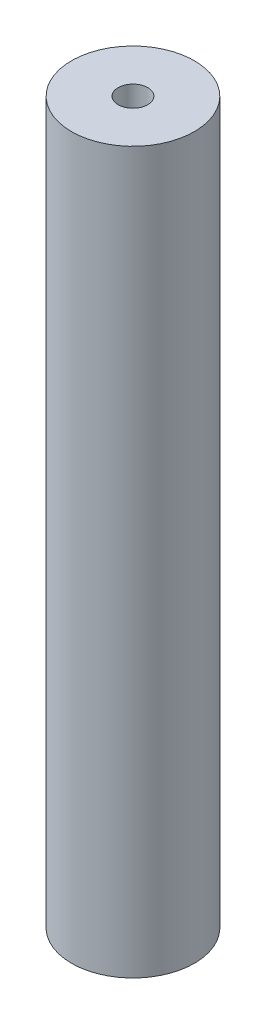
from build123d import *

# Parameters (mm, degrees)
SKETCH_4_R          = 2.9
EXTRUDE_1_DEPTH     = 34
SKETCH_4_5_R        = 0.7
CUT_EXTRUDE_1_DEPTH = 3
CUT_EXTRUDE_START   = 31
SKETCH_4_6_R        = 0.7
CUT_EXTRUDE_2_DEPTH = 3


with BuildPart() as part:
    # 草图4 → 凸台-拉伸1 (new body)
    with BuildSketch(Plane(origin=(0, 0, 0), x_dir=(1, 0, 0), z_dir=(0, 1, 0))):
        with Locations(Location((0, 0, 0), (0, 0, 270))):
            Circle(SKETCH_4_R)
    extrude(amount=EXTRUDE_1_DEPTH)

    # 草图4<5> → 切除-拉伸1 (cut)
    with BuildSketch(Plane(origin=(0, 0, 0), x_dir=(1, 0, 0), z_dir=(0, 1, 0))):
        with Locations(Location((0, 0, 0), (0, 0, 270))):
            Circle(SKETCH_4_5_R)
    extrude(amount=CUT_EXTRUDE_1_DEPTH, mode=Mode.SUBTRACT)

    # 草图4<6> → 切除-拉伸2 (cut)
    with BuildSketch(Plane(origin=(0, 0, 0), x_dir=(1, 0, 0), z_dir=(0, 1, 0)).offset(CUT_EXTRUDE_START)):
        with Locations(Location((0, 0, 0), (0, 0, 270))):
            Circle(SKETCH_4_6_R)
    extrude(amount=CUT_EXTRUDE_2_DEPTH, mode=Mode.SUBTRACT)


solid = part.part
